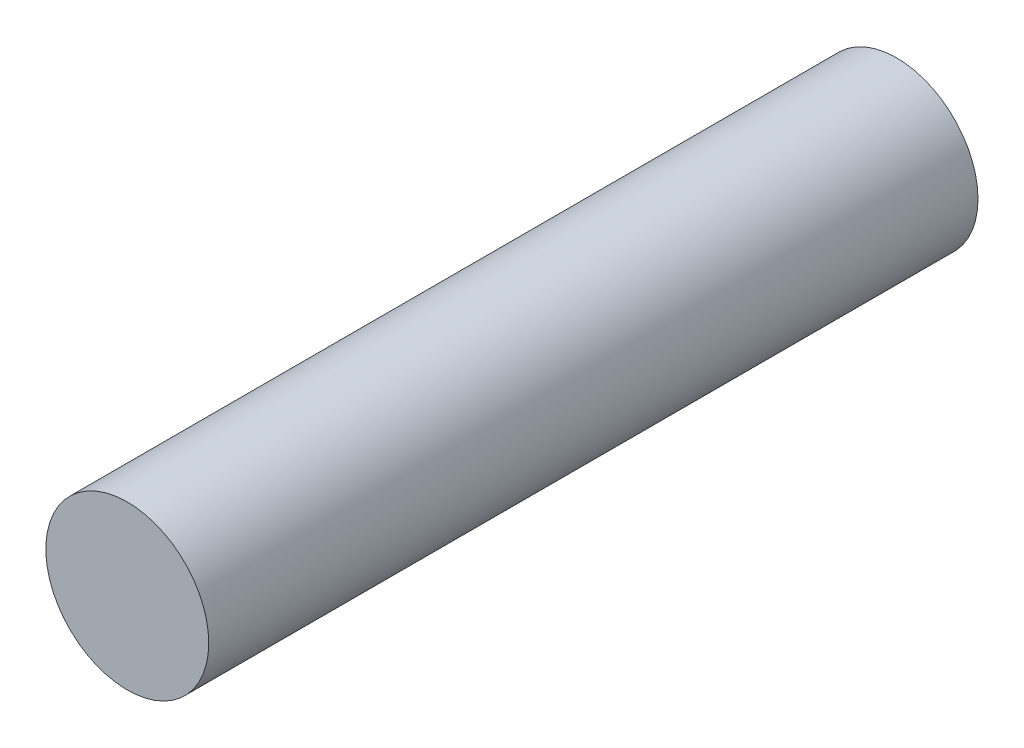
from build123d import *

# Parameters (mm, degrees)
SKETCH_1_R      = 9
EXTRUDE_1_DEPTH = 85


with BuildPart() as part:
    # 草图1 → 凸台-拉伸1 (new body)
    with BuildSketch(Plane.XY):
        Circle(SKETCH_1_R)
    extrude(amount=EXTRUDE_1_DEPTH)


solid = part.part
